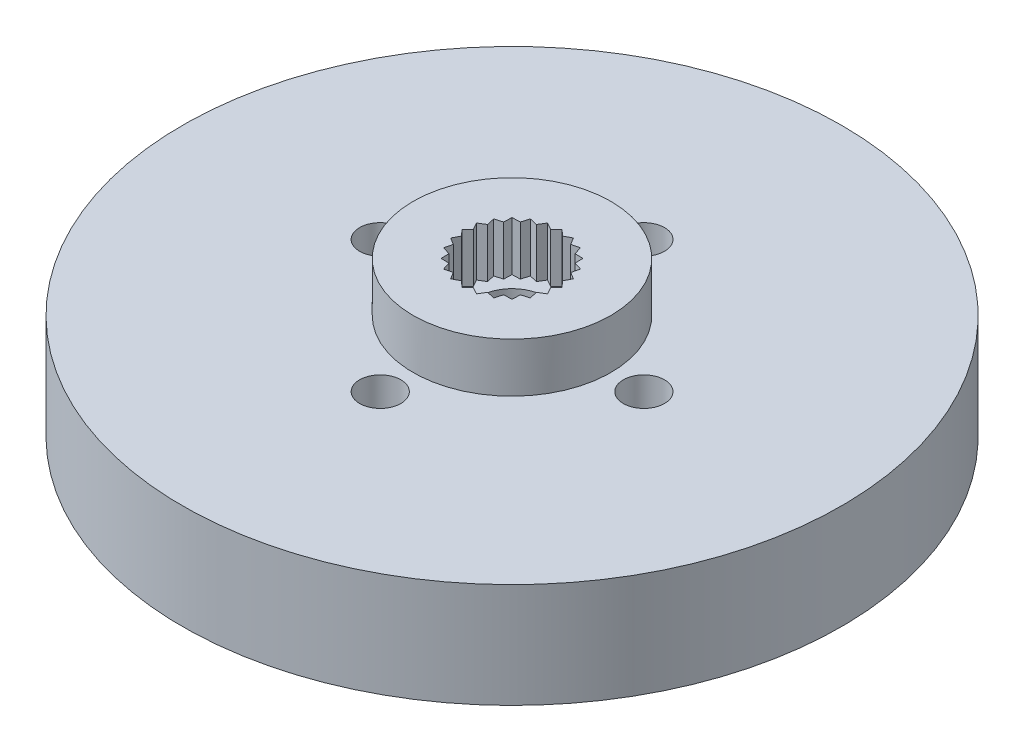
from build123d import *

# Parameters (mm, degrees)
SKETCH1_R           = 6
BOSS_EXTRUDE1_DEPTH = 3
SKETCH2_R           = 20
SKETCH2_R_2         = 2
SKETCH2_R_3         = 1.25
BOSS_EXTRUDE2_DEPTH = 6.35


with BuildPart() as part:
    # Sketch1 → Boss-Extrude1 (new body)
    with BuildSketch(Plane(origin=(0, 0, 0), x_dir=(1, 0, 0), z_dir=(0, 1, 0))):
        with Locations(Location((-0.004099667, 0.000679594, 0), (0, 0, 270))):
            Circle(SKETCH1_R)
        Polygon((-0.004099667, 3.041629594), (-0.360179239, 2.705372466), (-0.791155443, 2.938011735), (-1.048072148, 2.521052117), (-1.524574667, 2.634219546), (-1.664820058, 2.164972545), (-2.154376034, 2.15095596), (-2.168392618, 1.661399985), (-2.637639619, 1.521154594), (-2.52447219, 1.044652075), (-2.941431809, 0.787735369), (-2.708792539, 0.356759166), (-3.045049667, 0.000679594), (-2.708792539, -0.355399978), (-2.941431809, -0.786376181), (-2.52447219, -1.043292887), (-2.637639619, -1.519795406), (-2.168392618, -1.660040797), (-2.154376034, -2.149596772), (-1.664820058, -2.163613357), (-1.524574667, -2.632860358), (-1.048072148, -2.519692929), (-0.791155443, -2.936652547), (-0.360179239, -2.704013278), (-0.004099667, -3.040270406), (0.351979904, -2.704013278), (0.782956108, -2.936652547), (1.039872814, -2.519692929), (1.516375333, -2.632860358), (1.656620724, -2.163613357), (2.146176699, -2.149596772), (2.160193283, -1.660040797), (2.629440284, -1.519795406), (2.516272855, -1.043292887), (2.933232474, -0.786376181), (2.700593205, -0.355399978), (3.036850333, 0.000679594), (2.700593205, 0.356759166), (2.933232474, 0.787735369), (2.516272855, 1.044652075), (2.629440284, 1.521154594), (2.160193283, 1.661399985), (2.146176699, 2.15095596), (1.656620724, 2.164972545), (1.516375333, 2.634219546), (1.039872814, 2.521052117), (0.782956108, 2.938011735), (0.351979904, 2.705372466), align=None, mode=Mode.SUBTRACT)
    extrude(amount=BOSS_EXTRUDE1_DEPTH)

    # Sketch2 → Boss-Extrude2 (add)
    with BuildSketch(Plane.XZ):
        with Locations(Location((0, 0, 0), (0, 0, 270))):
            Circle(SKETCH2_R)
        with Locations(Location((0, 0, 0), (0, 0, 270))):
            Circle(SKETCH2_R_2, mode=Mode.SUBTRACT)
        with Locations(Location((8, 0, 0), (0, 0, 270))):
            Circle(SKETCH2_R_3, mode=Mode.SUBTRACT)
        with Locations(Location((0, -8, 0), (0, 0, 270))):
            Circle(SKETCH2_R_3, mode=Mode.SUBTRACT)
        with Locations(Location((-8, 0, 0), (0, 0, 270))):
            Circle(SKETCH2_R_3, mode=Mode.SUBTRACT)
        with Locations(Location((0, 8, 0), (0, 0, 270))):
            Circle(SKETCH2_R_3, mode=Mode.SUBTRACT)
    extrude(amount=BOSS_EXTRUDE2_DEPTH)


solid = part.part
